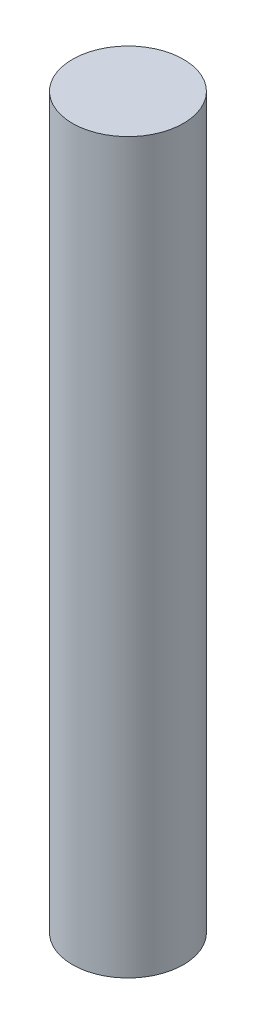
from build123d import *

# Parameters (mm, degrees)
SKETCH1_R           = 27.5
BOSS_EXTRUDE1_DEPTH = 361


with BuildPart() as part:
    # Sketch1 → Boss-Extrude1 (new body)
    with BuildSketch(Plane(origin=(0, 0, 0), x_dir=(1, 0, 0), z_dir=(0, 1, 0))):
        with Locations(Location((0, 0, 0), (0, 0, 270))):
            Circle(SKETCH1_R)
    extrude(amount=-BOSS_EXTRUDE1_DEPTH)


solid = part.part
